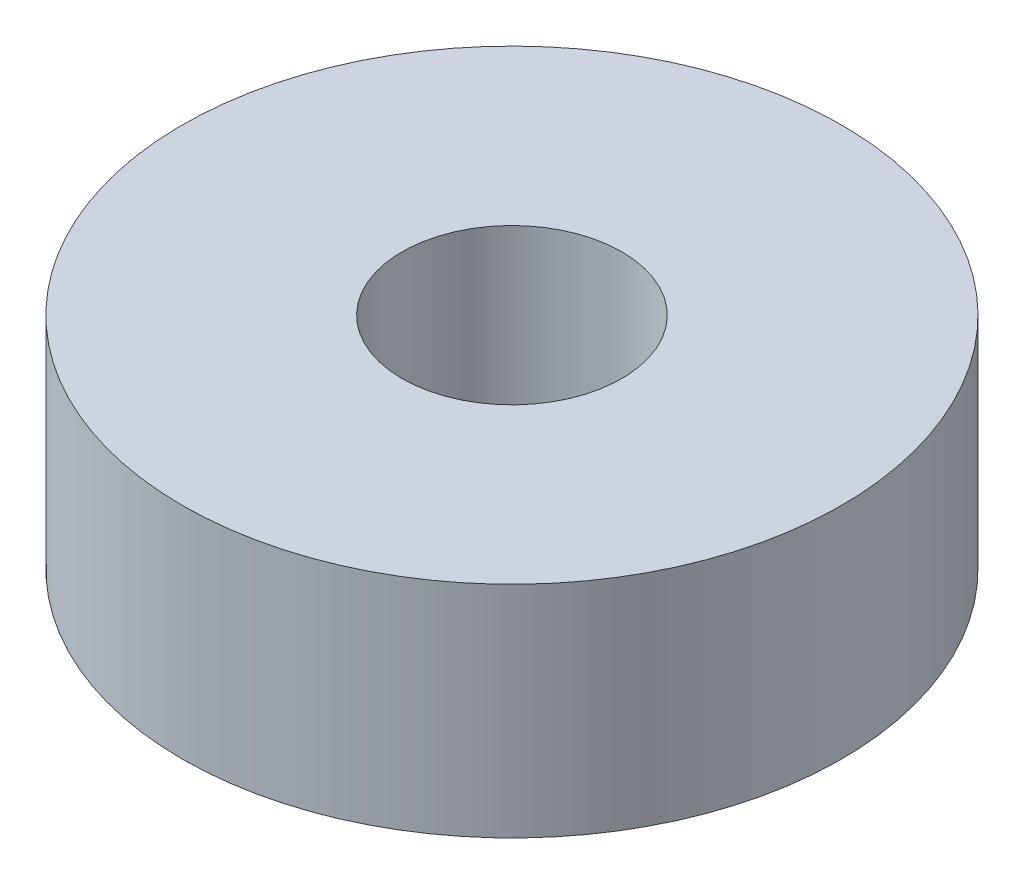
from build123d import *

# Parameters (mm, degrees)
SKETCH1_R           = 12
SKETCH1_R_2         = 4
BOSS_EXTRUDE1_DEPTH = 8


with BuildPart() as part:
    # Sketch1 → Boss-Extrude1 (new body)
    with BuildSketch(Plane(origin=(0, 0, 0), x_dir=(1, 0, 0), z_dir=(0, 1, 0))):
        with Locations(Location((0, 0, 0), (0, 0, 270))):
            Circle(SKETCH1_R)
        with Locations(Location((0, 0, 0), (0, 0, 270))):
            Circle(SKETCH1_R_2, mode=Mode.SUBTRACT)
    extrude(amount=BOSS_EXTRUDE1_DEPTH)


solid = part.part
